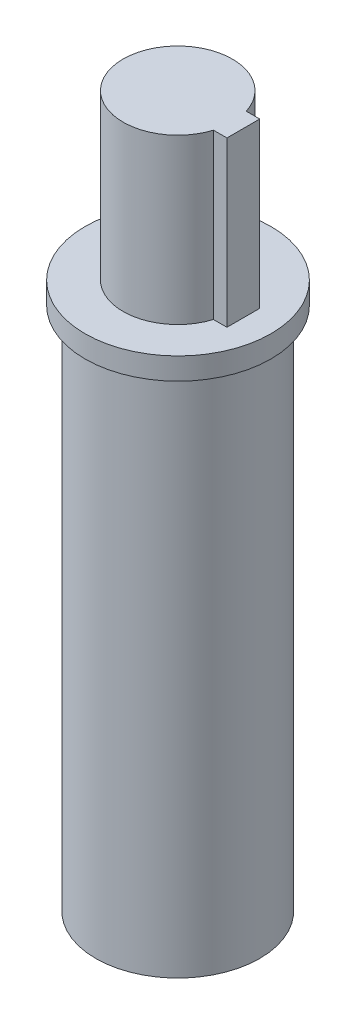
from build123d import *

# Parameters (mm, degrees)
BOSS_EXTRUDE1_DEPTH = 15
SKETCH2_R           = 7.5
BOSS_EXTRUDE2_DEPTH = 50
SCALE1_SCALE        = 10
SKETCH3_R           = 85
BOSS_EXTRUDE3_DEPTH = 20


with BuildPart() as part:
    # Sketch1 → Boss-Extrude1 (new body)
    with BuildSketch(Plane(origin=(0, 0, 0), x_dir=(1, 0, 0), z_dir=(0, 1, 0))):
        with BuildLine():
            Line((4.769696007, -1.5), (6, -1.5))
            Line((6, -1.5), (6, 1.5))
            Line((6, 1.5), (4.769696007, 1.5))
            ThreePointArc((4.769696007, 1.5), (-5, 0), (4.769696007, -1.5))
        make_face()
    extrude(amount=BOSS_EXTRUDE1_DEPTH)

    # Sketch2 → Boss-Extrude2 (add)
    with BuildSketch(Plane.XZ):
        with Locations(Location((0, 0, 0), (0, 0, 270))):
            Circle(SKETCH2_R)
    extrude(amount=BOSS_EXTRUDE2_DEPTH)


with BuildPart() as part_1:
    # Scale1: scaled about (0.026273948, -21.038472133, 0)
    add(part.part.scale(SCALE1_SCALE).moved(Location((-0.236465532, 189.346249197, 0))))

    # Sketch3 → Boss-Extrude3 (add)
    with BuildSketch(Plane(origin=(0, 189.346249199, 0), x_dir=(1, 0, 0), z_dir=(0, 1, 0))):
        with Locations(Location((0, 0, 0), (0, 0, 270))):
            Circle(SKETCH3_R)
    extrude(amount=-BOSS_EXTRUDE3_DEPTH)


solid = part_1.part
